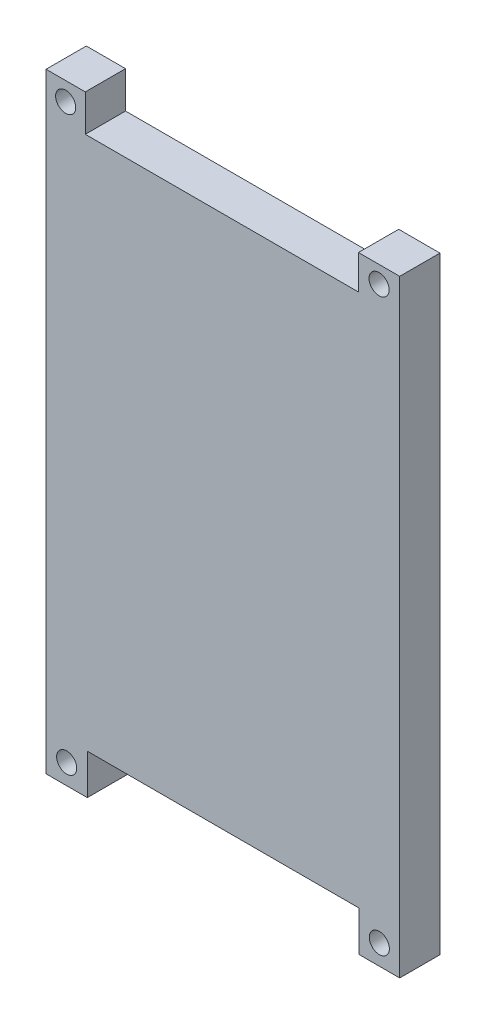
from build123d import *

# Parameters (mm, degrees)
SKETCH1_W           = 7.8
SKETCH1_H           = 7.3
SKETCH1_R           = 2
SKETCH1_W_2         = 8.2
SKETCH1_H_2         = 8
SKETCH1_H_3         = 6.8
SKETCH1_W_3         = 8.1
BOSS_EXTRUDE1_DEPTH = 8


with BuildPart() as part:
    # Sketch1 → Boss-Extrude1 (new body)
    # profile 1 of 5: a face of its own
    with BuildSketch(Plane.XY):
        with Locations((-31.25, 56.65)):
            Rectangle(SKETCH1_W, SKETCH1_H)
        with Locations((-31.25, 56.65)):
            Circle(SKETCH1_R, mode=Mode.SUBTRACT)
    # profile 2 of 5: a face of its own
    with BuildSketch(Plane.XY):
        Polygon((-27.35, 53), (-35.15, 53), (-35.15, -53), (-26.95, -53), (27.05, -53), (35.15, -53), (35.15, 53), (26.95, 53), align=None)
    # profile 3 of 5: a face of its own
    with BuildSketch(Plane.XY):
        with Locations((-31.05, -57)):
            Rectangle(SKETCH1_W_2, SKETCH1_H_2)
        with Locations((-31.05, -57)):
            Circle(SKETCH1_R, mode=Mode.SUBTRACT)
    # profile 4 of 5: a face of its own
    with BuildSketch(Plane.XY):
        with Locations((31.05, 56.4)):
            Rectangle(SKETCH1_W_2, SKETCH1_H_3)
        with Locations((31.05, 56.4)):
            Circle(SKETCH1_R, mode=Mode.SUBTRACT)
    # profile 5 of 5: a face of its own
    with BuildSketch(Plane.XY):
        with Locations((31.1, -57)):
            Rectangle(SKETCH1_W_3, SKETCH1_H_2)
        with Locations((31.1, -57)):
            Circle(SKETCH1_R, mode=Mode.SUBTRACT)
    extrude(amount=BOSS_EXTRUDE1_DEPTH)


solid = part.part
